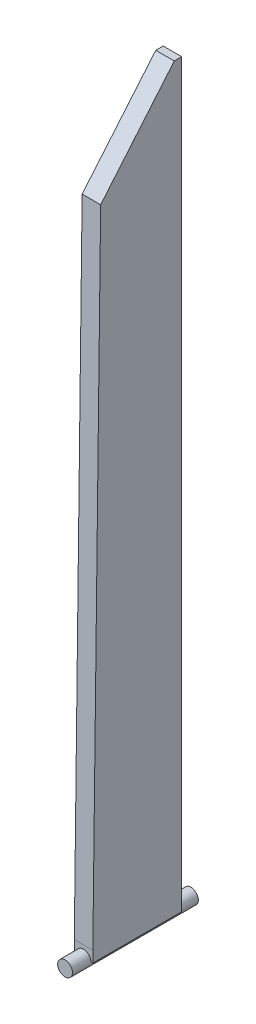
from build123d import *

# Parameters (mm, degrees)
SKETCH1_W                = 0.5
SKETCH1_H                = 20
BOSS_EXTRUDE1_DEPTH      = 2.4
BOSS_EXTRUDE2_DEPTH      = 0.5
BOSS_EXTRUDE2_DEPTH_BACK = 2.9
SKETCH2_R                = 0.2
CUT_EXTRUDE1_REACH       = 22.215


with BuildPart() as part:
    # Sketch1 → Boss-Extrude1 (new body)
    with BuildSketch(Plane.XY):
        with Locations((0, 10)):
            Rectangle(SKETCH1_W, SKETCH1_H)
    extrude(amount=BOSS_EXTRUDE1_DEPTH)

    # Sketch2 → Boss-Extrude2 (add, two sides: drawn at the far end of the back side and taken through both)
    with BuildSketch(Plane.XY.offset(2.4).offset(-BOSS_EXTRUDE2_DEPTH_BACK)):
        Circle(SKETCH2_R)
    extrude(amount=BOSS_EXTRUDE2_DEPTH + BOSS_EXTRUDE2_DEPTH_BACK)

    # Sketch3 → Cut-Extrude1 (cut, up to next)
    with BuildSketch(Plane(origin=(0.25, 0, 0), x_dir=(0, 0, -1), z_dir=(1, 0, 0)), mode=Mode.PRIVATE) as cut_extrude1_sk1:
        Polygon((-2.4, 0.3), (-3.130095712, 0.3), (-3.130095712, 41.705801687), (-0.2, 41.705801687), (-0.2, 20), (-2.188257625, 17.630486832), align=None)
    cut_extrude1_tool1 = extrude(cut_extrude1_sk1.sketch, amount=-CUT_EXTRUDE1_REACH, mode=Mode.PRIVATE) & part.part
    add(cut_extrude1_tool1.solids().sort_by_distance((0.25, 26.424814, 1.871))[0], mode=Mode.SUBTRACT)


solid = part.part
